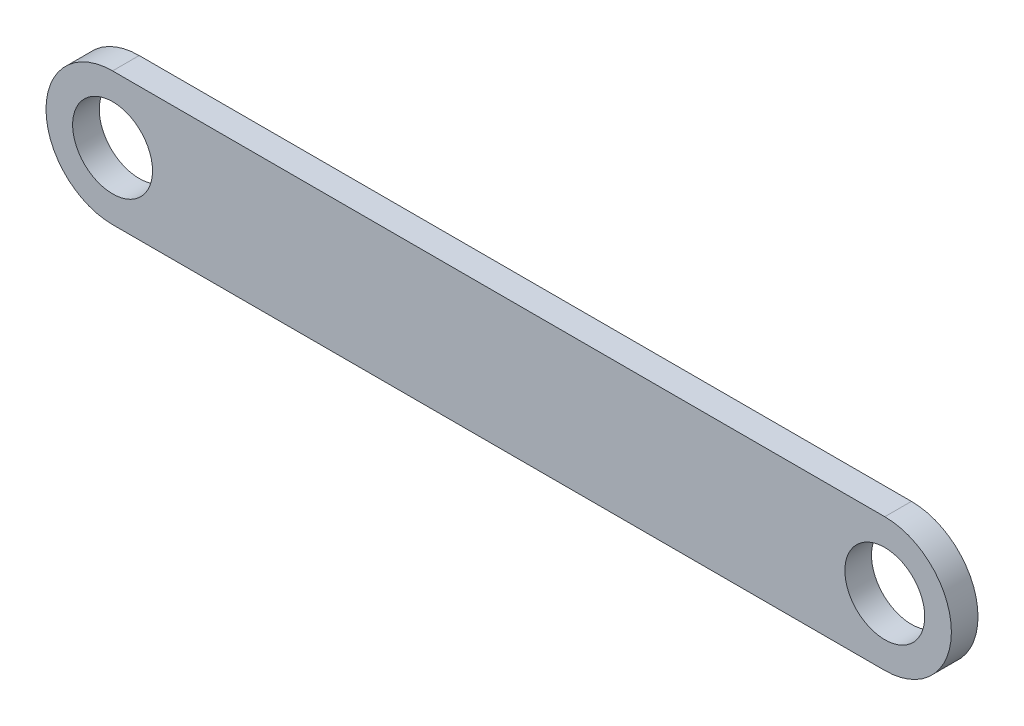
from build123d import *

# Parameters (mm, degrees)
SKETCH1_R           = 7.5
BOSS_EXTRUDE1_DEPTH = 2.5


with BuildPart() as part:
    # Sketch1 → Boss-Extrude1 (new, symmetric)
    with BuildSketch(Plane.XY):
        with BuildLine():
            Line((0, 12.5), (145, 12.5))
            ThreePointArc((145, 12.5), (157.5, 0), (145, -12.5))
            Line((145, -12.5), (0, -12.5))
            ThreePointArc((0, -12.5), (-12.5, 0), (0, 12.5))
        make_face()
        Circle(SKETCH1_R, mode=Mode.SUBTRACT)
        with Locations((145, 0)):
            Circle(SKETCH1_R, mode=Mode.SUBTRACT)
    extrude(amount=BOSS_EXTRUDE1_DEPTH, both=True)


solid = part.part
